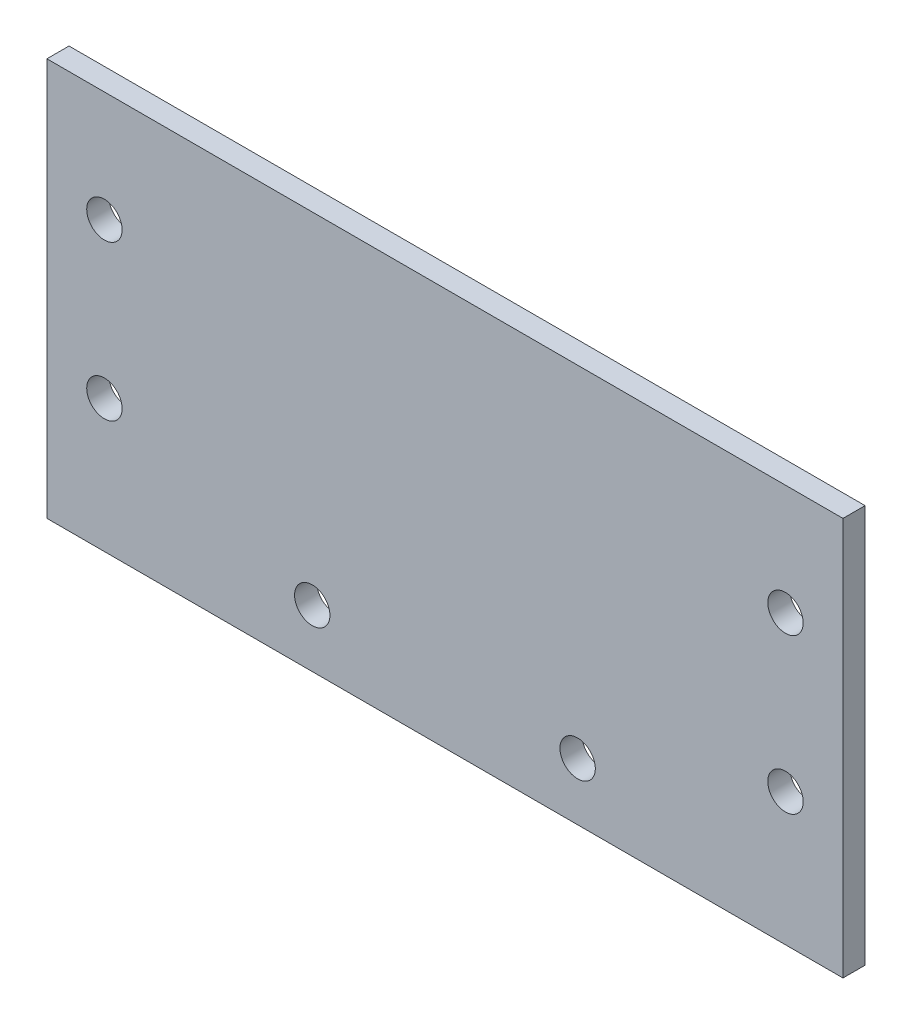
from build123d import *

# Parameters (mm, degrees)
SKETCH1_W             = 180
SKETCH1_H             = 90
BOSS_EXTRUDE1_DEPTH   = 5
F_1_0MM_DOWEL_HOLE1_D = 8


with BuildPart() as part:
    # Sketch1 → Boss-Extrude1 (new body)
    with BuildSketch(Plane.XY):
        with Locations((90, 45)):
            Rectangle(SKETCH1_W, SKETCH1_H)
    extrude(amount=BOSS_EXTRUDE1_DEPTH)

    # Ø1.0mm Dowel Hole1 (through all)
    with Locations(Plane(origin=(0, 0, 0), x_dir=(-1, 0, 0), z_dir=(0, 0, -1))):
        with Locations((-167, 65), (-167, 30), (-120, 13), (-60, 13), (-13, 30), (-13, 65)):
            Hole(F_1_0MM_DOWEL_HOLE1_D / 2)


solid = part.part
